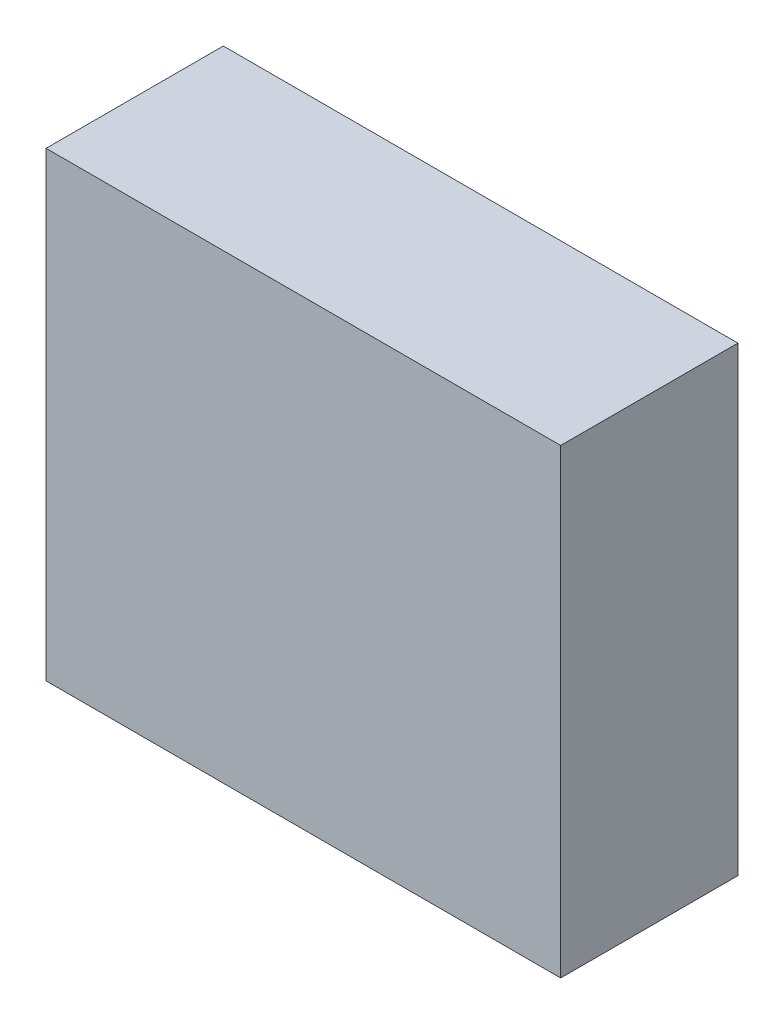
from build123d import *

# Parameters (mm, degrees)
ESQUISSE1_W        = 45.3
ESQUISSE1_H        = 40.6
BOSS_EXTRU_1_DEPTH = 15.6


with BuildPart() as part:
    # Esquisse1 → Boss.-Extru.1 (new body)
    with BuildSketch(Plane.XY):
        with Locations((22.65, 20.3)):
            Rectangle(ESQUISSE1_W, ESQUISSE1_H)
    extrude(amount=BOSS_EXTRU_1_DEPTH)


solid = part.part
